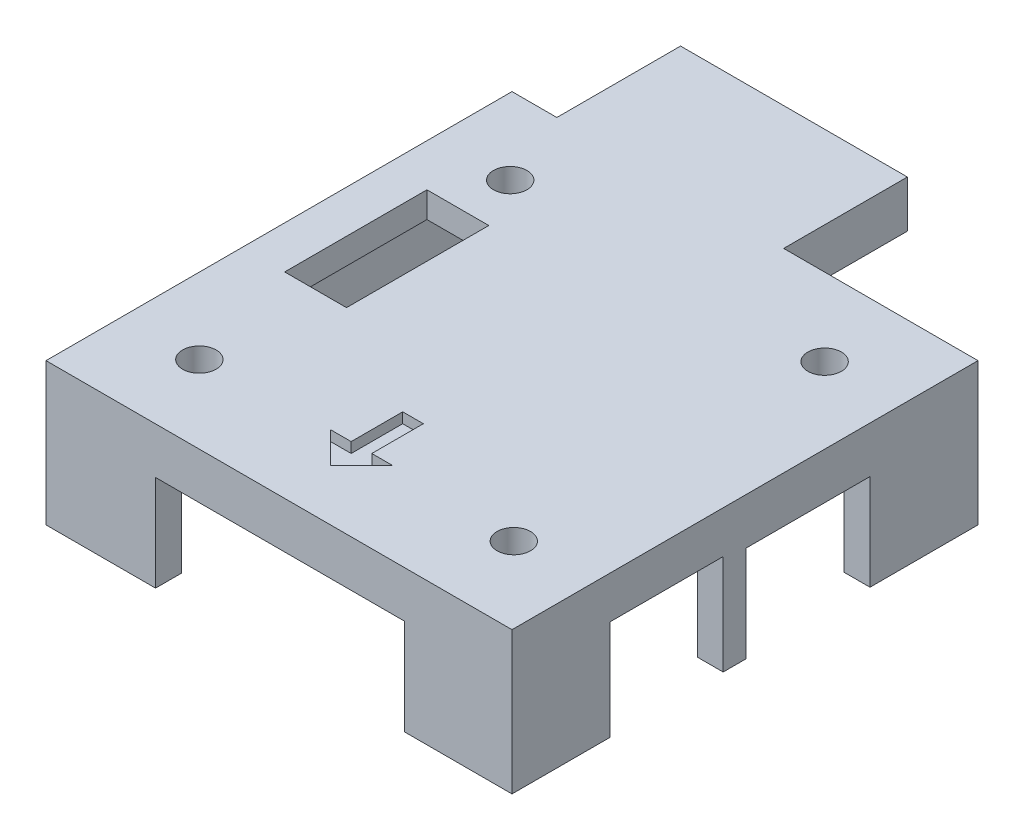
from build123d import *

# Parameters (mm, degrees)
SKETCH2_W                 = 45.2
SKETCH2_H                 = 45.2
SKETCH2_R                 = 1.625
TOP_DEPTH                 = 2.5
SKETCH2_3_W               = 45.2
SKETCH2_3_H               = 45.2
SKETCH2_3_W_2             = 40.2
SKETCH2_3_H_2             = 40.2
SIDE_WALLS_DEPTH          = 11.3
DIRECTION_INDICATOR_DEPTH = 1
FRONT_PORTS_REACH         = 53.783
WIFI_PORT_REACH           = 36.813
SKETCH5_W                 = 6
SKETCH5_H                 = 13.8
RIGHT_PORTS_REACH         = 53.783
SKETCH6_W                 = 10.2
SKETCH6_H                 = 9.3
SKETCH6_W_2               = 11.55
SKETCH6_H_2               = 3.75
REAR_PORTS_REACH          = 53.783
LEFT_PORTS_REACH          = 53.783
SKETCH8_W                 = 12.05
SKETCH8_H                 = 9.3
BOSS_EXTRUDE3_DEPTH       = 12


with BuildPart() as part:
    # Sketch2 → Top (new body)
    with BuildSketch(Plane(origin=(0, 0, 0), x_dir=(1, 0, 0), z_dir=(0, 1, 0))):
        Rectangle(SKETCH2_W, SKETCH2_H)
        with Locations((-15.25, -15.075)):
            Circle(SKETCH2_R, mode=Mode.SUBTRACT)
        with Locations((15.25, -15.075)):
            Circle(SKETCH2_R, mode=Mode.SUBTRACT)
        with Locations((-15.25, 15.075)):
            Circle(SKETCH2_R, mode=Mode.SUBTRACT)
        with Locations((15.25, 15.075)):
            Circle(SKETCH2_R, mode=Mode.SUBTRACT)
    extrude(amount=TOP_DEPTH)

    # Sketch2<3> → Side Walls (add)
    with BuildSketch(Plane(origin=(0, 0, 0), x_dir=(1, 0, 0), z_dir=(0, 1, 0))):
        Rectangle(SKETCH2_3_W, SKETCH2_3_H)
        Rectangle(SKETCH2_3_W_2, SKETCH2_3_H_2, mode=Mode.SUBTRACT)
    extrude(amount=-SIDE_WALLS_DEPTH)

    # Sketch3 → Direction Indicator (cut)
    with BuildSketch(Plane(origin=(0, 2.5, 0), x_dir=(1, 0, 0), z_dir=(0, 1, 0))):
        Polygon((0, -17.6), (3, -14.6), (1, -14.6), (1, -9.6), (-1, -9.6), (-1, -14.6), (-3, -14.6), align=None)
    extrude(amount=-DIRECTION_INDICATOR_DEPTH, mode=Mode.SUBTRACT)

    # Sketch4 → Front Ports (cut, up to next)
    with BuildSketch(Plane.XY.offset(22.6), mode=Mode.PRIVATE) as front_ports_sk1:
        Polygon((-0.375, -2), (-11.975, -2), (-11.975, -11.3), (-0.375, -11.3), (12.175, -11.3), (12.175, -2), (0.575, -2), align=None)
    front_ports_tool1 = extrude(front_ports_sk1.sketch, amount=-FRONT_PORTS_REACH, mode=Mode.PRIVATE) & part.part
    add(front_ports_tool1.solids().sort_by_distance((0.1, -6.65, 22.6))[0], mode=Mode.SUBTRACT)

    # Sketch5 → Wifi Port (cut, up to next)
    with BuildSketch(Plane(origin=(0, 2.5, 0), x_dir=(1, 0, 0), z_dir=(0, 1, 0)), mode=Mode.PRIVATE) as wifi_port_sk1:
        with Locations((-15.475, 3.325)):
            Rectangle(SKETCH5_W, SKETCH5_H)
    wifi_port_tool1 = extrude(wifi_port_sk1.sketch, amount=-WIFI_PORT_REACH, mode=Mode.PRIVATE) & part.part
    add(wifi_port_tool1.solids().sort_by_distance((-15.475, 2.5, -3.325))[0], mode=Mode.SUBTRACT)

    # Sketch6 → Right Ports (cut, up to next)
    with BuildSketch(Plane.ZY.offset(22.6), mode=Mode.PRIVATE) as right_ports_sk1:
        with Locations((7.075, -6.65)):
            Rectangle(SKETCH6_W, SKETCH6_H)
    right_ports_tool1 = extrude(right_ports_sk1.sketch, amount=-RIGHT_PORTS_REACH, mode=Mode.PRIVATE) & part.part
    # Sketch6 → Right Ports (cut, up to next)
    with BuildSketch(Plane.ZY.offset(22.6), mode=Mode.PRIVATE) as right_ports_sk2:
        with Locations((-6.45, -9.425)):
            Rectangle(SKETCH6_W_2, SKETCH6_H_2)
    right_ports_tool2 = extrude(right_ports_sk2.sketch, amount=-RIGHT_PORTS_REACH, mode=Mode.PRIVATE) & part.part
    add(right_ports_tool1.solids().sort_by_distance((-22.6, -6.65, 7.075))[0], mode=Mode.SUBTRACT)
    add(right_ports_tool2.solids().sort_by_distance((-22.6, -9.425, -6.45))[0], mode=Mode.SUBTRACT)

    # Sketch7 → Rear Ports (cut, up to next)
    with BuildSketch(Plane(origin=(0, 0, -22.6), x_dir=(-1, 0, 0), z_dir=(0, 0, -1)), mode=Mode.PRIVATE) as rear_ports_sk1:
        Polygon((15.25, -11.3), (15.25, 0), (-0.75, 0), (-0.75, -2.05), (-12.225, -2.05), (-12.225, -11.3), align=None)
    rear_ports_tool1 = extrude(rear_ports_sk1.sketch, amount=-REAR_PORTS_REACH, mode=Mode.PRIVATE) & part.part
    add(rear_ports_tool1.solids().sort_by_distance((-2.168343, -6.029159, -22.6))[0], mode=Mode.SUBTRACT)

    # Sketch8 → Left Ports (cut, up to next)
    with BuildSketch(Plane(origin=(22.6, 0, 0), x_dir=(0, 0, -1), z_dir=(1, 0, 0)), mode=Mode.PRIVATE) as left_ports_sk1:
        with Locations((6.1, -6.65)):
            Rectangle(SKETCH8_W, SKETCH8_H)
    left_ports_tool1 = extrude(left_ports_sk1.sketch, amount=-LEFT_PORTS_REACH, mode=Mode.PRIVATE) & part.part
    # Sketch8 → Left Ports (cut, up to next)
    with BuildSketch(Plane(origin=(22.6, 0, 0), x_dir=(0, 0, -1), z_dir=(1, 0, 0)), mode=Mode.PRIVATE) as left_ports_sk2:
        Polygon((-13.118203812, -9.6), (-13.118203812, -15.896164494), (-2.118203812, -15.896164494), (-2.118203812, -9.6), (-2.118203812, -1.6), (-13.118203812, -1.6), align=None)
    left_ports_tool2 = extrude(left_ports_sk2.sketch, amount=-LEFT_PORTS_REACH, mode=Mode.PRIVATE) & part.part
    add(left_ports_tool1.solids().sort_by_distance((22.6, -6.65, -6.1))[0], mode=Mode.SUBTRACT)
    add(left_ports_tool2.solids().sort_by_distance((22.6, -8.748082, 7.618204))[0], mode=Mode.SUBTRACT)

    # Sketch9 → Boss-Extrude3 (add)
    with BuildSketch(Plane(origin=(0, 0, -22.6), x_dir=(-1, 0, 0), z_dir=(0, 0, -1))):
        Polygon((-3.75, -2.05), (-1.75, -2.05), (-1.75, 1), (16.25, 1), (16.25, -11.3), (18.25, -11.3), (18.25, 2.5), (-3.75, 2.5), align=None)
    extrude(amount=BOSS_EXTRUDE3_DEPTH)


solid = part.part
